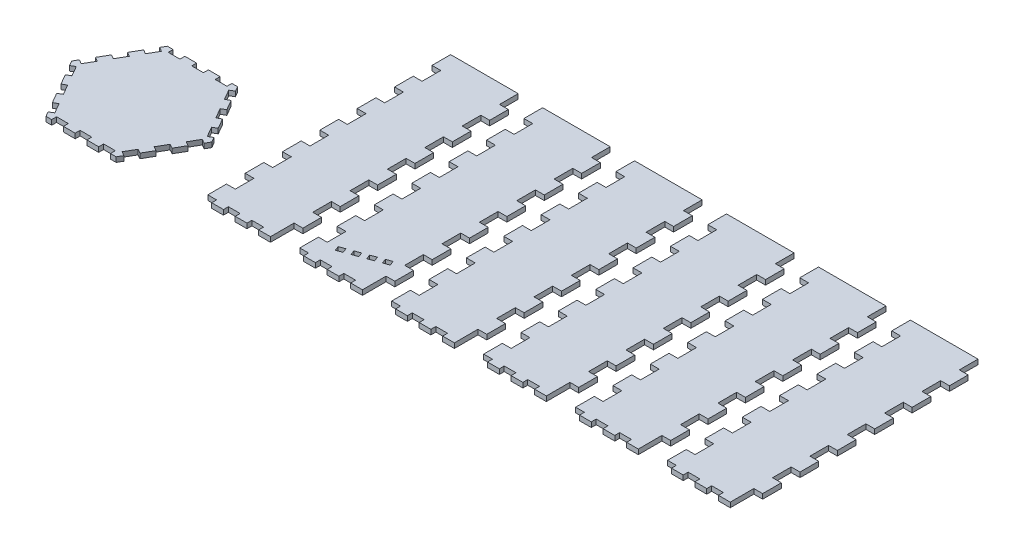
from build123d import *

# Parameters (mm, degrees)
BOSS_EXTRUDE3_DEPTH   = 3.2
BOSS_EXTRUDE3_2_DEPTH = 3.2
BOSS_EXTRUDE3_3_DEPTH = 3.2
BOSS_EXTRUDE3_4_DEPTH = 3.2
BOSS_EXTRUDE3_5_DEPTH = 3.2
BOSS_EXTRUDE3_6_DEPTH = 3.2
BOSS_EXTRUDE3_7_DEPTH = 3.2


with BuildPart() as part:
    # Sketch1 → Boss-Extrude3 (new body)
    with BuildSketch(Plane(origin=(0, 0, 0), x_dir=(1, 0, 0), z_dir=(0, 1, 0))):
        Polygon((-22.869998863, -39.612), (-19.17495714, -39.612), (-19.17495714, -36.412), (-11.504974284, -36.412), (-11.504974284, -39.612), (-3.834991428, -39.612), (-3.834991428, -36.412), (3.834991428, -36.412), (3.834991428, -39.612), (11.504974284, -39.612), (11.504974284, -36.412), (19.17495714, -36.412), (19.17495714, -39.612), (22.869998863, -39.612), (24.717519725, -36.412), (21.946238432, -34.812), (25.781229861, -28.1696), (28.552511153, -29.7696), (32.387502581, -23.1272), (29.616221289, -21.5272), (33.451212717, -14.8848), (36.222494009, -16.4848), (40.057485437, -9.8424), (37.286204145, -8.2424), (41.121195573, -1.6), (43.892476865, -3.2), (45.739997726, 0), (43.892476865, 3.2), (41.121195573, 1.6), (37.286204145, 8.2424), (40.057485437, 9.8424), (36.222494009, 16.4848), (33.451212717, 14.8848), (29.616221289, 21.5272), (32.387502581, 23.1272), (28.552511153, 29.7696), (25.781229861, 28.1696), (21.946238432, 34.812), (24.717519725, 36.412), (22.869998863, 39.612), (19.17495714, 39.612), (19.17495714, 36.412), (11.504974284, 36.412), (11.504974284, 39.612), (3.834991428, 39.612), (3.834991428, 36.412), (-3.834991428, 36.412), (-3.834991428, 39.612), (-11.504974284, 39.612), (-11.504974284, 36.412), (-19.17495714, 36.412), (-19.17495714, 39.612), (-22.869998863, 39.612), (-24.717519725, 36.412), (-21.946238432, 34.812), (-25.781229861, 28.1696), (-28.552511153, 29.7696), (-32.387502581, 23.1272), (-29.616221289, 21.5272), (-33.451212717, 14.8848), (-36.222494009, 16.4848), (-40.057485437, 9.8424), (-37.286204145, 8.2424), (-41.121195573, 1.6), (-43.892476865, 3.2), (-45.739997726, 0), (-43.892476865, -3.2), (-41.121195573, -1.6), (-37.286204145, -8.2424), (-40.057485437, -9.8424), (-36.222494009, -16.4848), (-33.451212717, -14.8848), (-29.616221289, -21.5272), (-32.387502581, -23.1272), (-28.552511153, -29.7696), (-25.781229861, -28.1696), (-21.946238432, -34.812), (-24.717519725, -36.412), align=None)
    extrude(amount=BOSS_EXTRUDE3_DEPTH)


with BuildPart() as body_2:
    # Sketch1 → Boss-Extrude3 2 (new body)
    with BuildSketch(Plane(origin=(0, 0, 0), x_dir=(1, 0, 0), z_dir=(0, 1, 0))):
        Polygon((80.018202502, -34.385003933), (87.688185358, -34.385003933), (87.688185358, -31.185003933), (95.358168214, -31.185003933), (95.358168214, -34.385003933), (103.02815107, -34.385003933), (103.02815107, -31.185003933), (110.698133926, -31.185003933), (110.698133926, -34.385003933), (118.368116782, -34.385003933), (118.368116782, -18.996696241), (124.110679366, -18.996696241), (124.110679366, -6.808388549), (118.368116782, -6.808388549), (118.368116782, 5.379919143), (124.110679366, 5.379919143), (124.110679366, 17.568226836), (118.368116782, 17.568226836), (118.368116782, 29.756534528), (124.110679366, 29.756534528), (124.110679366, 41.94484222), (118.368116782, 41.94484222), (118.368116782, 54.133149913), (124.110679366, 54.133149913), (124.110679366, 66.321457605), (118.368116782, 66.321457605), (118.368116782, 78.509765297), (124.110679366, 78.509765297), (124.110679366, 90.69807299), (118.368116782, 90.69807299), (118.368116782, 102.886380682), (124.110679366, 102.886380682), (124.110679366, 115.074688374), (118.368116782, 115.074688374), (118.368116782, 127.262996067), (74.275639917, 127.262996067), (74.275639917, 115.074688374), (80.018202502, 115.074688374), (80.018202502, 102.886380682), (74.275639917, 102.886380682), (74.275639917, 90.69807299), (80.018202502, 90.69807299), (80.018202502, 78.509765297), (74.275639917, 78.509765297), (74.275639917, 66.321457605), (80.018202502, 66.321457605), (80.018202502, 54.133149913), (74.275639917, 54.133149913), (74.275639917, 41.94484222), (80.018202502, 41.94484222), (80.018202502, 29.756534528), (74.275639917, 29.756534528), (74.275639917, 17.568226836), (80.018202502, 17.568226836), (80.018202502, 5.379919143), (74.275639917, 5.379919143), (74.275639917, -6.808388549), (80.018202502, -6.808388549), (80.018202502, -18.996696241), (74.275639917, -18.996696241), (74.275639917, -31.185003933), (80.018202502, -31.185003933), align=None)
    extrude(amount=BOSS_EXTRUDE3_2_DEPTH)


with BuildPart() as body_3:
    # Sketch1 → Boss-Extrude3 3 (new body)
    with BuildSketch(Plane(origin=(0, 0, 0), x_dir=(1, 0, 0), z_dir=(0, 1, 0))):
        Polygon((140.018202502, -34.385003933), (147.688185358, -34.385003933), (147.688185358, -31.185003933), (155.358168214, -31.185003933), (155.358168214, -34.385003933), (163.02815107, -34.385003933), (163.02815107, -31.185003933), (170.698133926, -31.185003933), (170.698133926, -34.385003933), (178.368116782, -34.385003933), (178.368116782, -18.996696241), (184.110679366, -18.996696241), (184.110679366, -6.808388549), (178.368116782, -6.808388549), (178.368116782, 5.379919143), (184.110679366, 5.379919143), (184.110679366, 17.568226836), (178.368116782, 17.568226836), (178.368116782, 29.756534528), (184.110679366, 29.756534528), (184.110679366, 41.94484222), (178.368116782, 41.94484222), (178.368116782, 54.133149913), (184.110679366, 54.133149913), (184.110679366, 66.321457605), (178.368116782, 66.321457605), (178.368116782, 78.509765297), (184.110679366, 78.509765297), (184.110679366, 90.69807299), (178.368116782, 90.69807299), (178.368116782, 102.886380682), (184.110679366, 102.886380682), (184.110679366, 115.074688374), (178.368116782, 115.074688374), (178.368116782, 127.262996067), (134.275639917, 127.262996067), (134.275639917, 115.074688374), (140.018202502, 115.074688374), (140.018202502, 102.886380682), (134.275639917, 102.886380682), (134.275639917, 90.69807299), (140.018202502, 90.69807299), (140.018202502, 78.509765297), (134.275639917, 78.509765297), (134.275639917, 66.321457605), (140.018202502, 66.321457605), (140.018202502, 54.133149913), (134.275639917, 54.133149913), (134.275639917, 41.94484222), (140.018202502, 41.94484222), (140.018202502, 29.756534528), (134.275639917, 29.756534528), (134.275639917, 17.568226836), (140.018202502, 17.568226836), (140.018202502, 5.379919143), (134.275639917, 5.379919143), (134.275639917, -6.808388549), (140.018202502, -6.808388549), (140.018202502, -18.996696241), (134.275639917, -18.996696241), (134.275639917, -31.185003933), (140.018202502, -31.185003933), align=None)
        Polygon((161.126064694, -12.448654355), (164.884835178, -11.080573782), (165.979299636, -14.087590168), (162.220529153, -15.455670741), align=None, mode=Mode.SUBTRACT)
        Polygon((146.090982762, -17.920976648), (149.849753245, -16.552896075), (150.944217704, -19.559912461), (147.185447221, -20.927993035), align=None, mode=Mode.SUBTRACT)
        Polygon((153.608523728, -15.184815502), (157.367294211, -13.816734928), (158.46175867, -16.823751315), (154.702988187, -18.191831888), align=None, mode=Mode.SUBTRACT)
        Polygon((168.643605661, -9.712493208), (172.402376144, -8.344412635), (173.496840603, -11.351429022), (169.738070119, -12.719509595), align=None, mode=Mode.SUBTRACT)
    extrude(amount=BOSS_EXTRUDE3_3_DEPTH)


with BuildPart() as body_4:
    # Sketch1 → Boss-Extrude3 4 (new body)
    with BuildSketch(Plane(origin=(0, 0, 0), x_dir=(1, 0, 0), z_dir=(0, 1, 0))):
        Polygon((200.018202502, -34.385003933), (207.688185358, -34.385003933), (207.688185358, -31.185003933), (215.358168214, -31.185003933), (215.358168214, -34.385003933), (223.02815107, -34.385003933), (223.02815107, -31.185003933), (230.698133926, -31.185003933), (230.698133926, -34.385003933), (238.368116782, -34.385003933), (238.368116782, -18.996696241), (244.110679366, -18.996696241), (244.110679366, -6.808388549), (238.368116782, -6.808388549), (238.368116782, 5.379919143), (244.110679366, 5.379919143), (244.110679366, 17.568226836), (238.368116782, 17.568226836), (238.368116782, 29.756534528), (244.110679366, 29.756534528), (244.110679366, 41.94484222), (238.368116782, 41.94484222), (238.368116782, 54.133149913), (244.110679366, 54.133149913), (244.110679366, 66.321457605), (238.368116782, 66.321457605), (238.368116782, 78.509765297), (244.110679366, 78.509765297), (244.110679366, 90.69807299), (238.368116782, 90.69807299), (238.368116782, 102.886380682), (244.110679366, 102.886380682), (244.110679366, 115.074688374), (238.368116782, 115.074688374), (238.368116782, 127.262996067), (194.275639917, 127.262996067), (194.275639917, 115.074688374), (200.018202502, 115.074688374), (200.018202502, 102.886380682), (194.275639917, 102.886380682), (194.275639917, 90.69807299), (200.018202502, 90.69807299), (200.018202502, 78.509765297), (194.275639917, 78.509765297), (194.275639917, 66.321457605), (200.018202502, 66.321457605), (200.018202502, 54.133149913), (194.275639917, 54.133149913), (194.275639917, 41.94484222), (200.018202502, 41.94484222), (200.018202502, 29.756534528), (194.275639917, 29.756534528), (194.275639917, 17.568226836), (200.018202502, 17.568226836), (200.018202502, 5.379919143), (194.275639917, 5.379919143), (194.275639917, -6.808388549), (200.018202502, -6.808388549), (200.018202502, -18.996696241), (194.275639917, -18.996696241), (194.275639917, -31.185003933), (200.018202502, -31.185003933), align=None)
    extrude(amount=BOSS_EXTRUDE3_4_DEPTH)


with BuildPart() as body_5:
    # Sketch1 → Boss-Extrude3 5 (new body)
    with BuildSketch(Plane(origin=(0, 0, 0), x_dir=(1, 0, 0), z_dir=(0, 1, 0))):
        Polygon((260.018202502, -34.385003933), (267.688185358, -34.385003933), (267.688185358, -31.185003933), (275.358168214, -31.185003933), (275.358168214, -34.385003933), (283.02815107, -34.385003933), (283.02815107, -31.185003933), (290.698133926, -31.185003933), (290.698133926, -34.385003933), (298.368116782, -34.385003933), (298.368116782, -18.996696241), (304.110679366, -18.996696241), (304.110679366, -6.808388549), (298.368116782, -6.808388549), (298.368116782, 5.379919143), (304.110679366, 5.379919143), (304.110679366, 17.568226836), (298.368116782, 17.568226836), (298.368116782, 29.756534528), (304.110679366, 29.756534528), (304.110679366, 41.94484222), (298.368116782, 41.94484222), (298.368116782, 54.133149913), (304.110679366, 54.133149913), (304.110679366, 66.321457605), (298.368116782, 66.321457605), (298.368116782, 78.509765297), (304.110679366, 78.509765297), (304.110679366, 90.69807299), (298.368116782, 90.69807299), (298.368116782, 102.886380682), (304.110679366, 102.886380682), (304.110679366, 115.074688374), (298.368116782, 115.074688374), (298.368116782, 127.262996067), (254.275639917, 127.262996067), (254.275639917, 115.074688374), (260.018202502, 115.074688374), (260.018202502, 102.886380682), (254.275639917, 102.886380682), (254.275639917, 90.69807299), (260.018202502, 90.69807299), (260.018202502, 78.509765297), (254.275639917, 78.509765297), (254.275639917, 66.321457605), (260.018202502, 66.321457605), (260.018202502, 54.133149913), (254.275639917, 54.133149913), (254.275639917, 41.94484222), (260.018202502, 41.94484222), (260.018202502, 29.756534528), (254.275639917, 29.756534528), (254.275639917, 17.568226836), (260.018202502, 17.568226836), (260.018202502, 5.379919143), (254.275639917, 5.379919143), (254.275639917, -6.808388549), (260.018202502, -6.808388549), (260.018202502, -18.996696241), (254.275639917, -18.996696241), (254.275639917, -31.185003933), (260.018202502, -31.185003933), align=None)
    extrude(amount=BOSS_EXTRUDE3_5_DEPTH)


with BuildPart() as body_6:
    # Sketch1 → Boss-Extrude3 6 (new body)
    with BuildSketch(Plane(origin=(0, 0, 0), x_dir=(1, 0, 0), z_dir=(0, 1, 0))):
        Polygon((320.018202502, -34.385003933), (327.688185358, -34.385003933), (327.688185358, -31.185003933), (335.358168214, -31.185003933), (335.358168214, -34.385003933), (343.02815107, -34.385003933), (343.02815107, -31.185003933), (350.698133926, -31.185003933), (350.698133926, -34.385003933), (358.368116782, -34.385003933), (358.368116782, -18.996696241), (364.110679366, -18.996696241), (364.110679366, -6.808388549), (358.368116782, -6.808388549), (358.368116782, 5.379919143), (364.110679366, 5.379919143), (364.110679366, 17.568226836), (358.368116782, 17.568226836), (358.368116782, 29.756534528), (364.110679366, 29.756534528), (364.110679366, 41.94484222), (358.368116782, 41.94484222), (358.368116782, 54.133149913), (364.110679366, 54.133149913), (364.110679366, 66.321457605), (358.368116782, 66.321457605), (358.368116782, 78.509765297), (364.110679366, 78.509765297), (364.110679366, 90.69807299), (358.368116782, 90.69807299), (358.368116782, 102.886380682), (364.110679366, 102.886380682), (364.110679366, 115.074688374), (358.368116782, 115.074688374), (358.368116782, 127.262996067), (314.275639917, 127.262996067), (314.275639917, 115.074688374), (320.018202502, 115.074688374), (320.018202502, 102.886380682), (314.275639917, 102.886380682), (314.275639917, 90.69807299), (320.018202502, 90.69807299), (320.018202502, 78.509765297), (314.275639917, 78.509765297), (314.275639917, 66.321457605), (320.018202502, 66.321457605), (320.018202502, 54.133149913), (314.275639917, 54.133149913), (314.275639917, 41.94484222), (320.018202502, 41.94484222), (320.018202502, 29.756534528), (314.275639917, 29.756534528), (314.275639917, 17.568226836), (320.018202502, 17.568226836), (320.018202502, 5.379919143), (314.275639917, 5.379919143), (314.275639917, -6.808388549), (320.018202502, -6.808388549), (320.018202502, -18.996696241), (314.275639917, -18.996696241), (314.275639917, -31.185003933), (320.018202502, -31.185003933), align=None)
    extrude(amount=BOSS_EXTRUDE3_6_DEPTH)


with BuildPart() as body_7:
    # Sketch1 → Boss-Extrude3 7 (new body)
    with BuildSketch(Plane(origin=(0, 0, 0), x_dir=(1, 0, 0), z_dir=(0, 1, 0))):
        Polygon((380.018202502, -34.385003933), (387.688185358, -34.385003933), (387.688185358, -31.185003933), (395.358168214, -31.185003933), (395.358168214, -34.385003933), (403.02815107, -34.385003933), (403.02815107, -31.185003933), (410.698133926, -31.185003933), (410.698133926, -34.385003933), (418.368116782, -34.385003933), (418.368116782, -18.996696241), (424.110679366, -18.996696241), (424.110679366, -6.808388549), (418.368116782, -6.808388549), (418.368116782, 5.379919143), (424.110679366, 5.379919143), (424.110679366, 17.568226836), (418.368116782, 17.568226836), (418.368116782, 29.756534528), (424.110679366, 29.756534528), (424.110679366, 41.94484222), (418.368116782, 41.94484222), (418.368116782, 54.133149913), (424.110679366, 54.133149913), (424.110679366, 66.321457605), (418.368116782, 66.321457605), (418.368116782, 78.509765297), (424.110679366, 78.509765297), (424.110679366, 90.69807299), (418.368116782, 90.69807299), (418.368116782, 102.886380682), (424.110679366, 102.886380682), (424.110679366, 115.074688374), (418.368116782, 115.074688374), (418.368116782, 127.262996067), (374.275639917, 127.262996067), (374.275639917, 115.074688374), (380.018202502, 115.074688374), (380.018202502, 102.886380682), (374.275639917, 102.886380682), (374.275639917, 90.69807299), (380.018202502, 90.69807299), (380.018202502, 78.509765297), (374.275639917, 78.509765297), (374.275639917, 66.321457605), (380.018202502, 66.321457605), (380.018202502, 54.133149913), (374.275639917, 54.133149913), (374.275639917, 41.94484222), (380.018202502, 41.94484222), (380.018202502, 29.756534528), (374.275639917, 29.756534528), (374.275639917, 17.568226836), (380.018202502, 17.568226836), (380.018202502, 5.379919143), (374.275639917, 5.379919143), (374.275639917, -6.808388549), (380.018202502, -6.808388549), (380.018202502, -18.996696241), (374.275639917, -18.996696241), (374.275639917, -31.185003933), (380.018202502, -31.185003933), align=None)
    extrude(amount=BOSS_EXTRUDE3_7_DEPTH)


solid = Compound([part.part, body_2.part, body_3.part, body_4.part, body_5.part, body_6.part, body_7.part])
